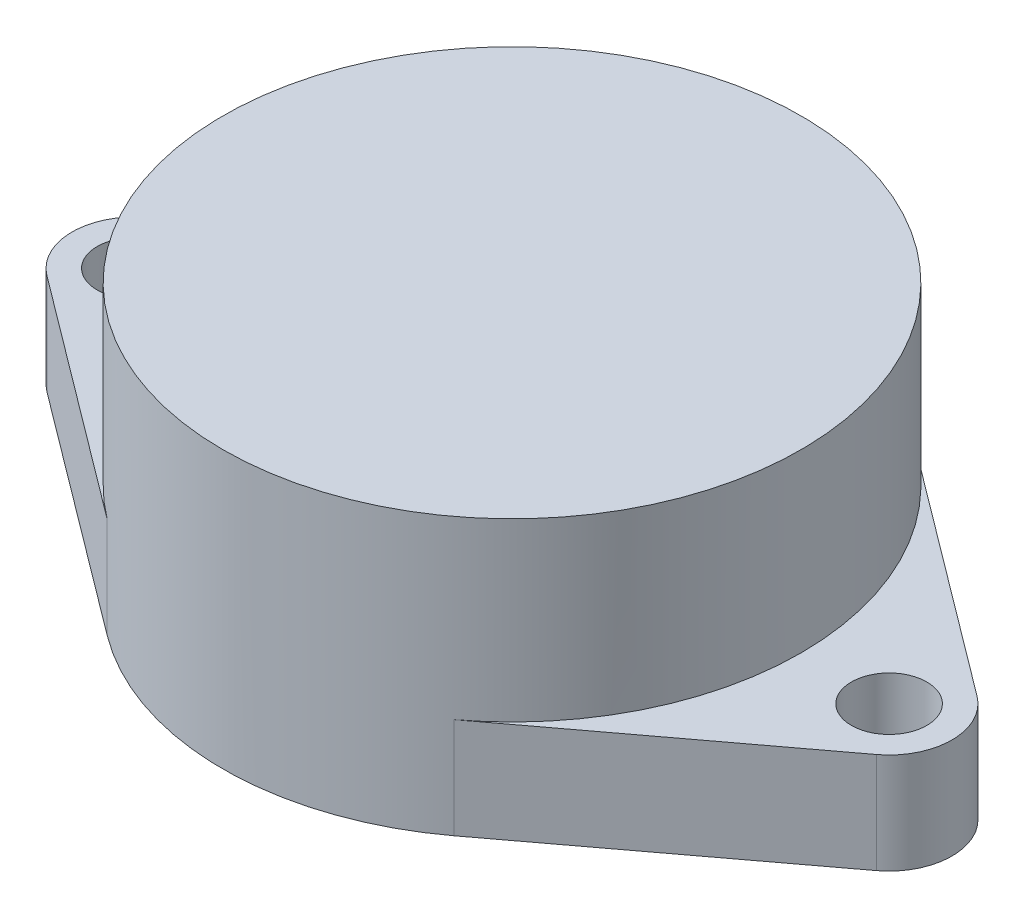
from build123d import *

# Parameters (mm, degrees)
CROQUIS1_R              = 1.5
SALIENTE_EXTRUIR1_DEPTH = 4
CROQUIS2_R              = 11.5
SALIENTE_EXTRUIR2_DEPTH = 7


with BuildPart() as part:
    # Croquis1 → Saliente-Extruir1 (new body)
    with BuildSketch(Plane(origin=(0, 0, 0), x_dir=(1, 0, 0), z_dir=(0, 1, 0))):
        with BuildLine():
            Line((16.5, 2), (6.9, 9.2))
            ThreePointArc((6.9, 9.2), (0, 11.5), (-6.9, 9.2))
            Line((-6.9, 9.2), (-16.5, 2))
            ThreePointArc((-16.5, 2), (-17.5, 0), (-16.5, -2))
            Line((-16.5, -2), (-6.9, -9.2))
            ThreePointArc((-6.9, -9.2), (0, -11.5), (6.9, -9.2))
            Line((6.9, -9.2), (16.5, -2))
            ThreePointArc((16.5, -2), (17.5, 0), (16.5, 2))
        make_face()
        with Locations(Location((-15, 0, 0), (0, 0, 270))):
            Circle(CROQUIS1_R, mode=Mode.SUBTRACT)
        with Locations(Location((15, 0, 0), (0, 0, 270))):
            Circle(CROQUIS1_R, mode=Mode.SUBTRACT)
    extrude(amount=SALIENTE_EXTRUIR1_DEPTH)

    # Croquis2 → Saliente-Extruir2 (add)
    with BuildSketch(Plane(origin=(0, 4, 0), x_dir=(1, 0, 0), z_dir=(0, 1, 0))):
        with Locations(Location((0, 0, 0), (0, 0, 53.130102354))):
            Circle(CROQUIS2_R)
    extrude(amount=SALIENTE_EXTRUIR2_DEPTH)


solid = part.part
